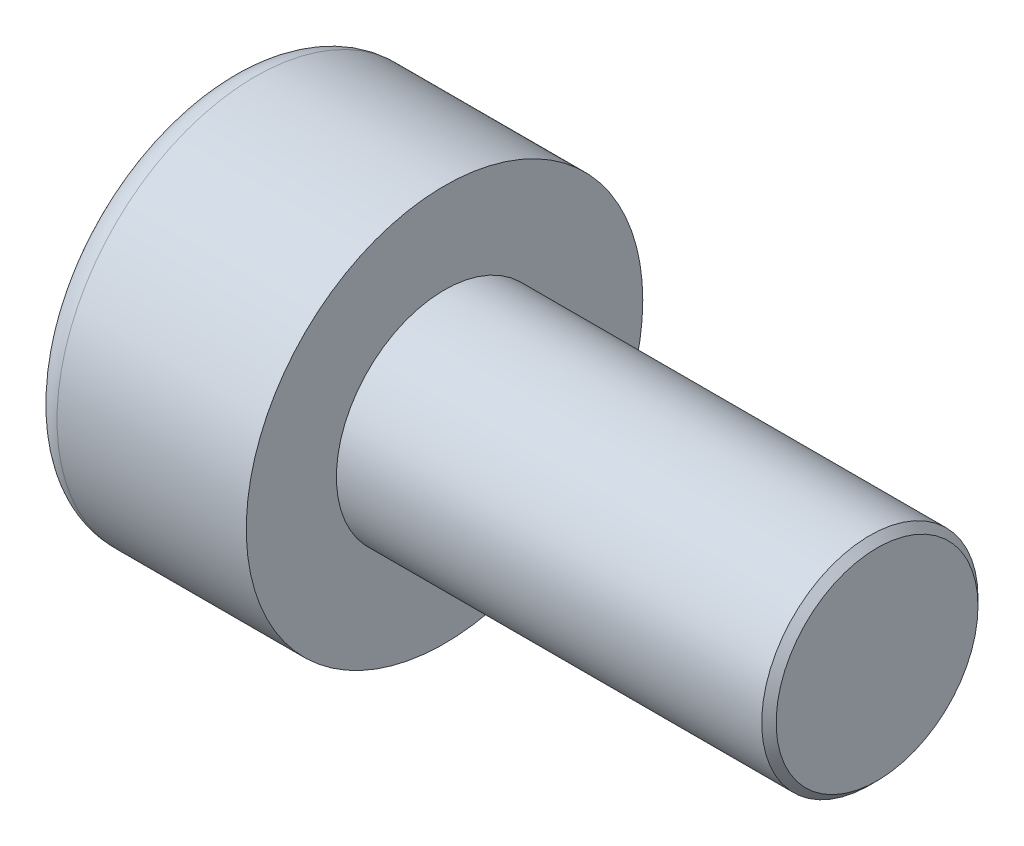
from build123d import *

# Parameters (mm, degrees)
SKETCH1_R           = 2.75
BASEHEAD_DEPTH      = 3
SKETCH2_R           = 1.5
BASEBODY_DEPTH      = 6
HEXAGONSOCKET_DEPTH = 1.3
TOPFILLET_R         = 0.375
CHAMFER1_SIZE       = 0.1


with BuildPart() as part:
    # Sketch1 → BaseHead (new body)
    with BuildSketch(Plane(origin=(0, 0, 0), x_dir=(0, 0, -1), z_dir=(1, 0, 0))):
        Circle(SKETCH1_R)
    extrude(amount=BASEHEAD_DEPTH)

    # Sketch2 → BaseBody (add)
    with BuildSketch(Plane(origin=(3, 0, 0), x_dir=(0, 0, -1), z_dir=(1, 0, 0))):
        Circle(SKETCH2_R)
    extrude(amount=BASEBODY_DEPTH)

    # Sketch3 → HexagonSocket (cut)
    with BuildSketch(Plane(origin=(0, 0, 0), x_dir=(0, 0, -1), z_dir=(1, 0, 0))):
        Polygon((1.443375673, 0), (0.721687836, 1.25), (-0.721687836, 1.25), (-1.443375673, 0), (-0.721687836, -1.25), (0.721687836, -1.25), align=None)
    extrude(amount=HEXAGONSOCKET_DEPTH, mode=Mode.SUBTRACT)

    # Sketch4 → Cut-Revolve1 (revolve, cut)
    with BuildSketch(Plane(origin=(-4.19613823, 0.75, 0), x_dir=(-1, 0, 0), z_dir=(0, 0, 1)), mode=Mode.PRIVATE) as cut_revolve1_sk:
        Polygon((-5.49613823, 2), (-6.217826066, 0.75), (-5.49613823, 0.75), align=None)
    revolve(cut_revolve1_sk.sketch.rotate(Axis((0.838992387, 0, 0), (-1, 0, 0)), 90), axis=Axis((0.838992387, 0, 0), (-1, 0, 0)), mode=Mode.SUBTRACT)

    # TopFillet
    topfillet_edges = [part.edges().sort_by_distance(p)[0] for p in [
        (0, 0, 2.75),
    ]]
    fillet(topfillet_edges, radius=TOPFILLET_R)

    # Chamfer1
    chamfer1_edges = [part.edges().sort_by_distance(p)[0] for p in [
        (9, 0, 1.5),
    ]]
    chamfer(chamfer1_edges, length=CHAMFER1_SIZE)


solid = part.part
